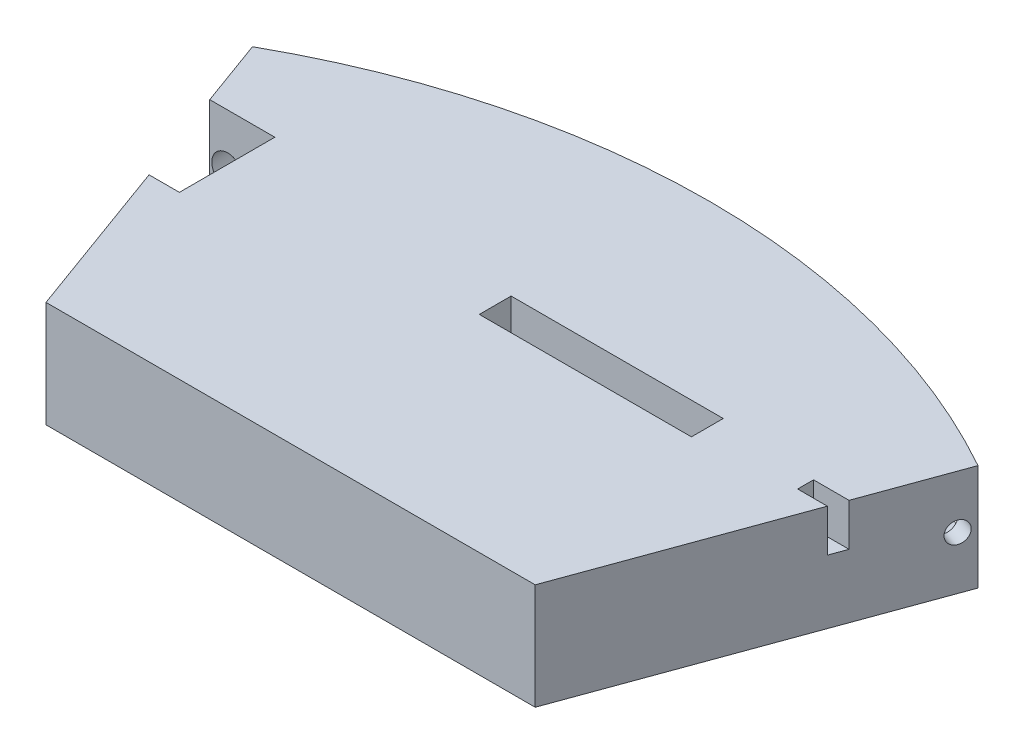
from build123d import *

# Parameters (mm, degrees)
EXTRUDE_1_DEPTH            = 48
CUT_EXTRUDE_2_REACH        = 96.508
CUT_EXTRUDE_2_START_RADIUS = 70
CUT_EXTRUDE_2_END_RADIUS   = 70
SKETCH_3_W                 = 58.404028666
SKETCH_3_H                 = 6
EXTRUDE_2_DEPTH            = 13
CUT_EXTRUDE_3_DEPTH        = 140.034418617
CUT_EXTRUDE_3_DEPTH_BACK   = 140.034418617
SKETCH_4_W                 = 25
SKETCH_4_H                 = 38
SKETCH_4_W_2               = 40
SKETCH_4_H_2               = 25
CHAMFER_1_SIZE             = 5
CHAMFER_1_SIZE2            = 3.813196151
SKETCH_6_R                 = 6.5
CUT_EXTRUDE_4_DEPTH        = 2
SKETCH_7_R                 = 1.5
CUT_EXTRUDE_5_DEPTH        = 60
SKETCH_8_W                 = 9
SKETCH_8_H                 = 9
CUT_EXTRUDE_6_DEPTH        = 11
CUT_EXTRUDE_8_REACH        = 137.533
SKETCH_10_R                = 1
CUT_EXTRUDE_9_REACH        = 105.034
CUT_EXTRUDE_9_END_RADIUS   = 70
SKETCH_11_R                = 0.75
SKETCH_12_W                = 20
SKETCH_12_H                = 3
CUT_EXTRUDE_10_DEPTH       = 11
SKETCH_13_W                = 3.868283576
SKETCH_13_H                = 1.5
CUT_EXTRUDE_11_DEPTH       = 4
CUT_EXTRUDE_12_REACH       = 137.476
SKETCH_15_OUTSIDE_W        = 122.502
SKETCH_15_OUTSIDE_H        = 162.955
SKETCH_15_OUTSIDE_W_2      = 109.971714071
SKETCH_15_OUTSIDE_H_2      = 49.254432198
CUT_EXTRUDE_13_DEPTH       = 10


with BuildPart() as part:
    # 草图1 → 凸台-拉伸1 (new body)
    with BuildSketch(Plane(origin=(0, 0, 0), x_dir=(1, 0, 0), z_dir=(0, 1, 0))):
        with BuildLine():
            ThreePointArc((-9.396926208, -7.075874358), (-5.735764364, -11.847193368), (0, -13.655672925))
            Line((0, -13.655672925), (0, -5))
            ThreePointArc((0, -5), (-5, 0), (0, 5))
            Line((0, 5), (0, 70))
            ThreePointArc((0, 70), (-17.673593853, 67.732149533), (-34.202014333, 61.075545152))
            Line((-34.202014333, 61.075545152), (-9.396926208, -7.075874358))
        make_face()
        with BuildLine():
            Line((0, -5), (0, -13.655672925))
            ThreePointArc((0, -13.655672925), (5.735764364, -11.847193368), (9.396926208, -7.075874358))
            Line((9.396926208, -7.075874358), (34.202014333, 61.075545152))
            ThreePointArc((34.202014333, 61.075545152), (17.673593853, 67.732149533), (0, 70))
            Line((0, 70), (0, 5))
            ThreePointArc((0, 5), (3.535533906, 3.535533906), (5, 0))
            ThreePointArc((5, 0), (3.535533906, -3.535533906), (0, -5))
        make_face()
    extrude(amount=EXTRUDE_1_DEPTH)

    # 切除-拉伸2: from a cylinder face, 96.508 long prism both ways, kept between that surface and its translate by the depth
    cut_extrude_2_start = Plane(origin=(0, 5, 0), z_dir=(0, -1, 0)) * Cylinder(CUT_EXTRUDE_2_START_RADIUS, 334.016, mode=Mode.PRIVATE)
    cut_extrude_2_end = Plane(origin=(0, 5, 3), z_dir=(0, -1, 0)) * Cylinder(CUT_EXTRUDE_2_END_RADIUS, 334.016, mode=Mode.PRIVATE)
    # 草图3 → 切除-拉伸2 (cut, from a surface)
    with BuildSketch(Plane.XY, mode=Mode.PRIVATE) as cut_extrude_2_sk1:
        with Locations((3, 5)):
            Rectangle(SKETCH_3_W, SKETCH_3_H)
    cut_extrude_2_tool1 = extrude(cut_extrude_2_sk1.sketch, amount=CUT_EXTRUDE_2_REACH, both=True, mode=Mode.PRIVATE)
    add(((cut_extrude_2_tool1 & cut_extrude_2_start) - cut_extrude_2_end).solids().sort_by_distance((3, 5, -62.032204))[0], mode=Mode.SUBTRACT)

    # 草图2 → 凸台-拉伸2 (add)
    with BuildSketch(Plane(origin=(0, 48, 0), x_dir=(1, 0, 0), z_dir=(0, 1, 0))):
        Polygon((24.252642572, 33.739870901), (55.034455471, 118.312206771), (20.125623779, 80.877067961), (5.458790156, 40.580273767), align=None)
    extrude(amount=-EXTRUDE_2_DEPTH)

    # 草图4 → 切除-拉伸3 (cut, two sides: drawn at the far end of the back side and taken through both)
    with BuildSketch(Plane(origin=(0, 0, 0), x_dir=(0, 0, -1), z_dir=(1, 0, 0)).offset(-CUT_EXTRUDE_3_DEPTH_BACK)):
        with Locations((-1.155672925, 29)):
            Rectangle(SKETCH_4_W, SKETCH_4_H)
        with Locations((50.466884927, 22.5)):
            Rectangle(SKETCH_4_W_2, SKETCH_4_H_2)
    extrude(amount=CUT_EXTRUDE_3_DEPTH + CUT_EXTRUDE_3_DEPTH_BACK, mode=Mode.SUBTRACT)

    # 倒角1
    chamfer_1_edges = [part.edges().sort_by_distance(p)[0] for p in [
        (55.034455471, 41.5, -118.312206771),
    ]]
    chamfer_1_side = [part.faces().sort_by_distance(p)[0] for p in [
        (37.580039625, 41.5, -99.594637366),
    ]]
    chamfer(chamfer_1_edges, length=CHAMFER_1_SIZE, length2=CHAMFER_1_SIZE2, reference=chamfer_1_side[0])

    # 草图6 → 切除-拉伸4 (cut)
    with BuildSketch(Plane.XZ):
        with Locations(Location((0, 0, 0), (0, 0, 270))):
            Circle(SKETCH_6_R)
    extrude(amount=-CUT_EXTRUDE_4_DEPTH, mode=Mode.SUBTRACT)

    # 草图7 → 切除-拉伸5 (cut)
    with BuildSketch(Plane.XY):
        with Locations((-30.202014333, 5)):
            Circle(SKETCH_7_R)
    extrude(amount=-CUT_EXTRUDE_5_DEPTH, mode=Mode.SUBTRACT)

    # 草图8 → 切除-拉伸6 (cut)
    with BuildSketch(Plane(origin=(0, 10, 0), x_dir=(1, 0, 0), z_dir=(0, 1, 0))):
        with Locations((-30.258231885, 50.240091929)):
            Rectangle(SKETCH_8_W, SKETCH_8_H)
    extrude(amount=-CUT_EXTRUDE_6_DEPTH, mode=Mode.SUBTRACT)

    # 切除-拉伸8: up to this plane
    cut_extrude_8_end = Plane(origin=(32.202014333, 48, -62.153280468), z_dir=(-1, 0, 0))
    # 草图10 → 切除-拉伸8 (cut, up to the surface)
    with BuildSketch(Plane(origin=(10.571836839, 0, 3.847833931), x_dir=(0.34202014332566283, 0, -0.9396926207859106), z_dir=(0.9396926207859106, 0, 0.34202014332566283)), mode=Mode.PRIVATE) as cut_extrude_8_sk1:
        with Locations((67.590016934, 5)):
            Circle(SKETCH_10_R)
    cut_extrude_8_tool1 = split(extrude(cut_extrude_8_sk1.sketch, amount=-CUT_EXTRUDE_8_REACH, mode=Mode.PRIVATE), bisect_by=cut_extrude_8_end, keep=Keep.BOTH, mode=Mode.PRIVATE)
    add(cut_extrude_8_tool1.solids().sort_by_distance((33.688984, 5, -59.666006))[0], mode=Mode.SUBTRACT)

    # 切除-拉伸9: up to this cylinder (the profile starts inside it)
    cut_extrude_9_end = Plane(origin=(0, 5, 0), z_dir=(0, -1, 0)) * Cylinder(CUT_EXTRUDE_9_END_RADIUS, 351.068, mode=Mode.PRIVATE)
    # 草图11 → 切除-拉伸9 (cut, up to the surface)
    with BuildSketch(Plane.XY.offset(-60), mode=Mode.PRIVATE) as cut_extrude_9_sk1:
        with Locations((-30.202014333, 5)):
            Circle(SKETCH_11_R)
    cut_extrude_9_tool1 = extrude(cut_extrude_9_sk1.sketch, amount=-CUT_EXTRUDE_9_REACH, mode=Mode.PRIVATE) & cut_extrude_9_end
    add(cut_extrude_9_tool1.solids().sort_by_distance((-30.202014, 5, -60))[0], mode=Mode.SUBTRACT)

    # 草图12 → 切除-拉伸10 (cut)
    with BuildSketch(Plane(origin=(0, 10, 0), x_dir=(1, 0, 0), z_dir=(0, 1, 0))):
        with Locations((8.346963974, 51.411545488)):
            Rectangle(SKETCH_12_W, SKETCH_12_H)
    extrude(amount=-CUT_EXTRUDE_10_DEPTH, mode=Mode.SUBTRACT)

    # 草图13 → 切除-拉伸11 (cut)
    with BuildSketch(Plane(origin=(0, 10, 0), x_dir=(1, 0, 0), z_dir=(0, 1, 0))):
        with Locations((29.542762739, 51.411545488)):
            Rectangle(SKETCH_13_W, SKETCH_13_H)
    extrude(amount=-CUT_EXTRUDE_11_DEPTH, mode=Mode.SUBTRACT)

    # 草图14 → 切除-拉伸12 (cut, up to next)
    with BuildSketch(Plane(origin=(0, 48, 0), x_dir=(1, 0, 0), z_dir=(0, 1, 0)), mode=Mode.PRIVATE) as cut_extrude_12_sk1:
        Polygon((49.766128767, 108.223290792), (49.034775066, 108.905289152), (40.168796385, 99.397691031), (40.900150086, 98.715692671), align=None)
    cut_extrude_12_tool1 = extrude(cut_extrude_12_sk1.sketch, amount=-CUT_EXTRUDE_12_REACH, mode=Mode.PRIVATE) & part.part
    add(cut_extrude_12_tool1.solids().sort_by_distance((44.967463, 48, -103.810491))[0], mode=Mode.SUBTRACT)

    # 草图15 outside → 切除-拉伸13 (cut)
    with BuildSketch(Plane(origin=(0, 10, 0), x_dir=(1, 0, 0), z_dir=(0, 1, 0))):
        with Locations((9.764, 50.5365)):
            Rectangle(SKETCH_15_OUTSIDE_W, SKETCH_15_OUTSIDE_H)
        with Locations((3.943147272, 55.094101026)):
            Rectangle(SKETCH_15_OUTSIDE_W_2, SKETCH_15_OUTSIDE_H_2, mode=Mode.SUBTRACT)
    extrude(amount=-CUT_EXTRUDE_13_DEPTH, mode=Mode.SUBTRACT)


with BuildPart() as body_2:
    # of the pieces the cut leaves, the one that is kept (cut_extrude_13_keep)
    add(part.part.solids().sort_by_distance((23.0613731, 0, -30.466884927))[0])


solid = body_2.part
